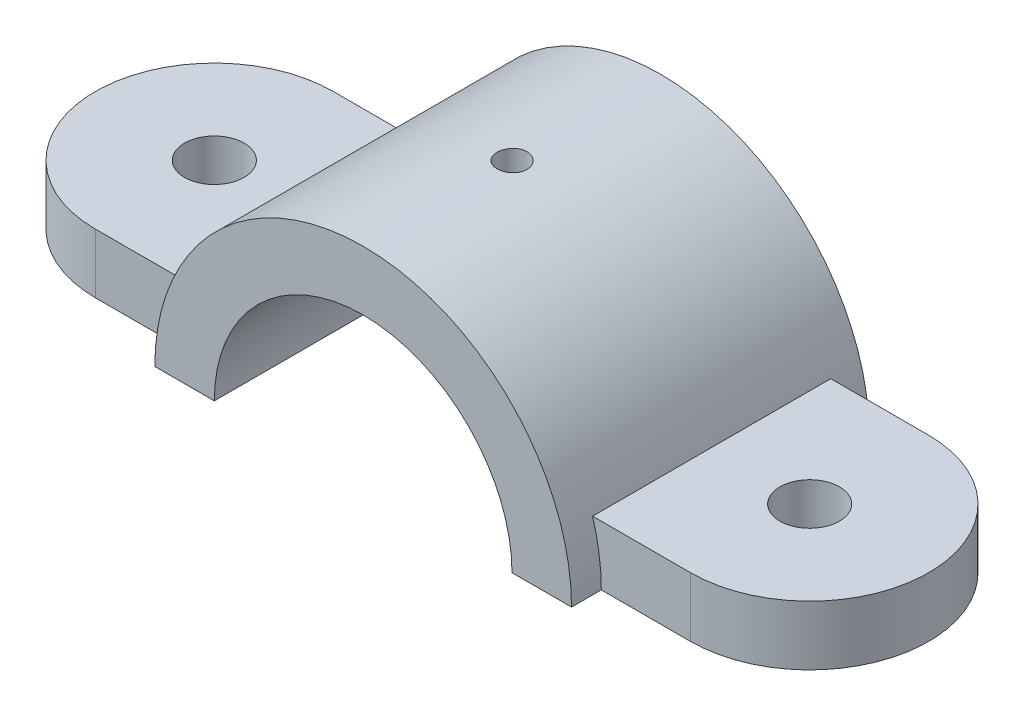
from build123d import *

# Parameters (mm, degrees)
SKETCH1_R               = 6.35
BASE_DEPTH              = 12.7
MAIN_BODY_DEPTH         = 31.75
CENTER_DRILL_D          = 6.35
CIRCULER_CUT_DEPTH      = 105.341147278
CIRCULER_CUT_DEPTH_BACK = 105.341147278
SKETCH7_R               = 31.75


with BuildPart() as part:
    # Sketch1 → base (new body)
    with BuildSketch(Plane(origin=(0, 0, 0), x_dir=(1, 0, 0), z_dir=(0, 1, 0))):
        with BuildLine():
            Line((-63.5, 25.4), (63.5, 25.4))
            ThreePointArc((63.5, 25.4), (88.9, 0), (63.5, -25.4))
            Line((63.5, -25.4), (-63.5, -25.4))
            ThreePointArc((-63.5, -25.4), (-88.9, 0), (-63.5, 25.4))
        make_face()
        with Locations(Location((-63.5, 0, 0), (0, 0, 270))):
            Circle(SKETCH1_R, mode=Mode.SUBTRACT)
        with Locations(Location((63.5, 0, 0), (0, 0, 90))):
            Circle(SKETCH1_R, mode=Mode.SUBTRACT)
    extrude(amount=BASE_DEPTH)

    # Sketch2 → main body (add, symmetric)
    with BuildSketch(Plane.XY):
        with BuildLine():
            Line((-44.45, 0), (44.45, 0))
            ThreePointArc((44.45, 0), (0, 44.45), (-44.45, 0))
        make_face()
    extrude(amount=MAIN_BODY_DEPTH, both=True)

    # center drill (through all)
    with Locations(Plane(origin=(0, 0, 0), x_dir=(-1, 0, 0), z_dir=(0, -1, 0))):
        with Locations((0, 0)):
            Hole(CENTER_DRILL_D / 2)

    # Sketch7 → circuler cut (cut, two sides: drawn at the far end of the back side and taken through both)
    with BuildSketch(Plane.XY.offset(-CIRCULER_CUT_DEPTH_BACK)):
        Circle(SKETCH7_R)
    extrude(amount=CIRCULER_CUT_DEPTH + CIRCULER_CUT_DEPTH_BACK, mode=Mode.SUBTRACT)


solid = part.part
